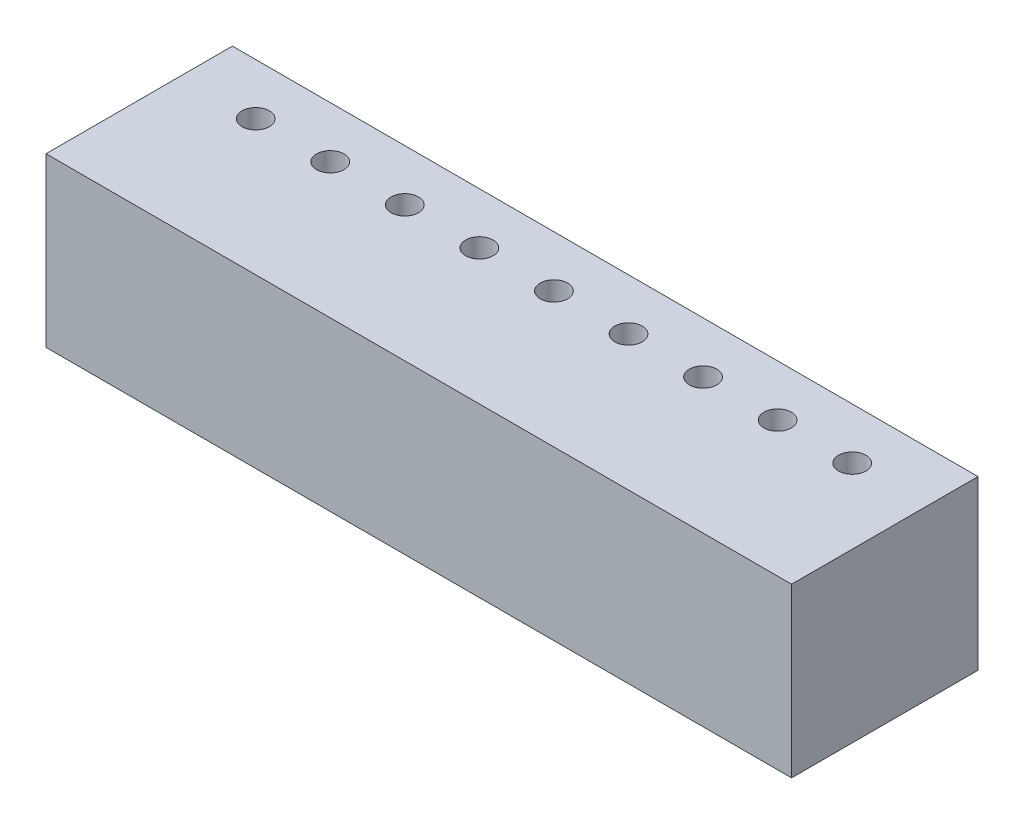
from build123d import *

# Parameters (mm, degrees)
SKETCH1_W           = 40
SKETCH1_H           = 10
SKETCH1_R           = 0.735294118
BOSS_EXTRUDE1_DEPTH = 9


with BuildPart() as part:
    # Sketch1 → Boss-Extrude1 (new body)
    with BuildSketch(Plane(origin=(0, 0, 0), x_dir=(1, 0, 0), z_dir=(0, 1, 0))):
        with Locations((8.455882353, 9.191176471)):
            Rectangle(SKETCH1_W, SKETCH1_H)
        with Locations(Location((24.455882353, 11.441176471, 0), (0, 0, 270))):
            Circle(SKETCH1_R, mode=Mode.SUBTRACT)
        with Locations(Location((20.455882353, 11.441176471, 0), (0, 0, 270))):
            Circle(SKETCH1_R, mode=Mode.SUBTRACT)
        with Locations(Location((16.455882353, 11.441176471, 0), (0, 0, 270))):
            Circle(SKETCH1_R, mode=Mode.SUBTRACT)
        with Locations(Location((12.455882353, 11.441176471, 0), (0, 0, 270))):
            Circle(SKETCH1_R, mode=Mode.SUBTRACT)
        with Locations(Location((8.455882353, 11.441176471, 0), (0, 0, 270))):
            Circle(SKETCH1_R, mode=Mode.SUBTRACT)
        with Locations(Location((4.455882353, 11.441176471, 0), (0, 0, 270))):
            Circle(SKETCH1_R, mode=Mode.SUBTRACT)
        with Locations(Location((0.455882353, 11.441176471, 0), (0, 0, 270))):
            Circle(SKETCH1_R, mode=Mode.SUBTRACT)
        with Locations(Location((-3.544117647, 11.441176471, 0), (0, 0, 270))):
            Circle(SKETCH1_R, mode=Mode.SUBTRACT)
        with Locations(Location((-7.544117647, 11.441176471, 0), (0, 0, 270))):
            Circle(SKETCH1_R, mode=Mode.SUBTRACT)
    extrude(amount=BOSS_EXTRUDE1_DEPTH)


solid = part.part
